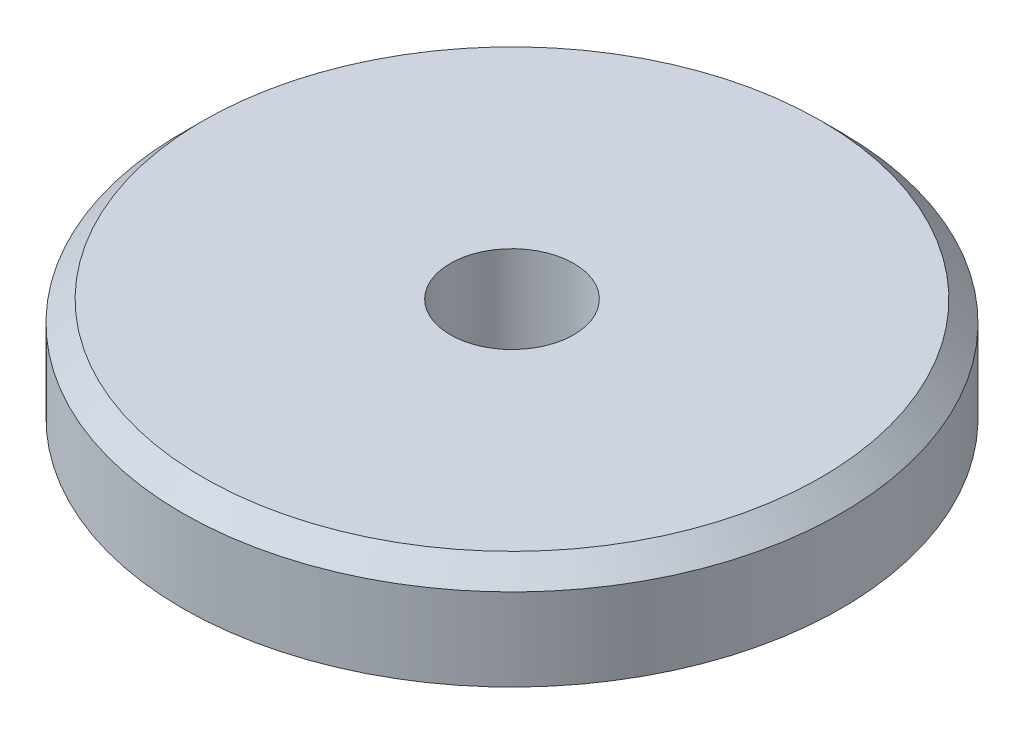
from build123d import *


with BuildPart() as part:
    # Эскиз1 → Повернуть1 (revolve)
    with BuildSketch(Plane.XY, mode=Mode.PRIVATE) as revolve_1_sk:
        Polygon((-3, -1.069151648), (-16, -1.069151648), (-16, 2.930848352), (-15, 3.930848352), (-3, 3.930848352), align=None)
    revolve(revolve_1_sk.sketch.rotate(Axis((0, 0, 0), (0, 1, 0)), 270), axis=Axis((0, 0, 0), (0, 1, 0)))


solid = part.part
